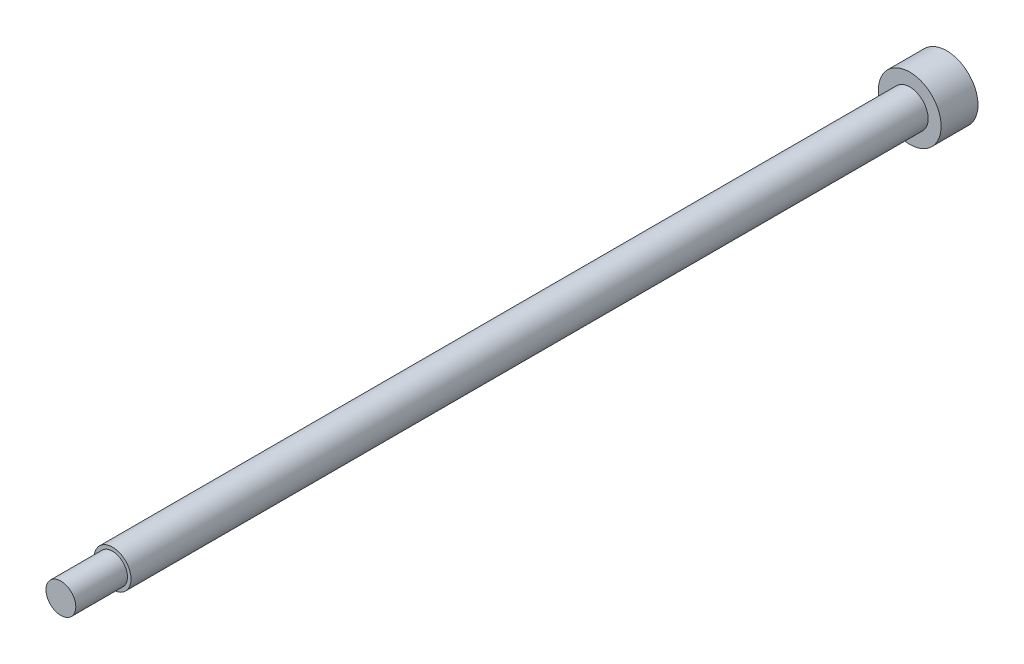
from build123d import *

# Parameters (mm, degrees)
M5_START                                       = 7
SKETCH1_R                                      = 2.5
M5_MOUNTING_BOLT_SHANK_AND_REDUCED_THREA_DEPTH = 108
M5_START_2                                     = 115
SKETCH2_R                                      = 2.02
M5_TAP_ENGAGEMENT_DEPTH                        = 7
SOCKET_START                                   = 2
SKETCH3_R                                      = 4.25
SOCKET_CAP_HEAD_DEPTH                          = 5


with BuildPart() as part:
    # Sketch1 → M5 mounting bolt shank and reduced thread representation (new body)
    with BuildSketch(Plane.XY.offset(M5_START)):
        Circle(SKETCH1_R)
    extrude(amount=M5_MOUNTING_BOLT_SHANK_AND_REDUCED_THREA_DEPTH)

    # Sketch2 → M5 tap engagement (add)
    with BuildSketch(Plane.XY.offset(M5_START_2)):
        Circle(SKETCH2_R)
    extrude(amount=M5_TAP_ENGAGEMENT_DEPTH)

    # Sketch3 → Socket cap head (add)
    with BuildSketch(Plane.XY.offset(SOCKET_START)):
        Circle(SKETCH3_R)
    extrude(amount=SOCKET_CAP_HEAD_DEPTH)


solid = part.part
